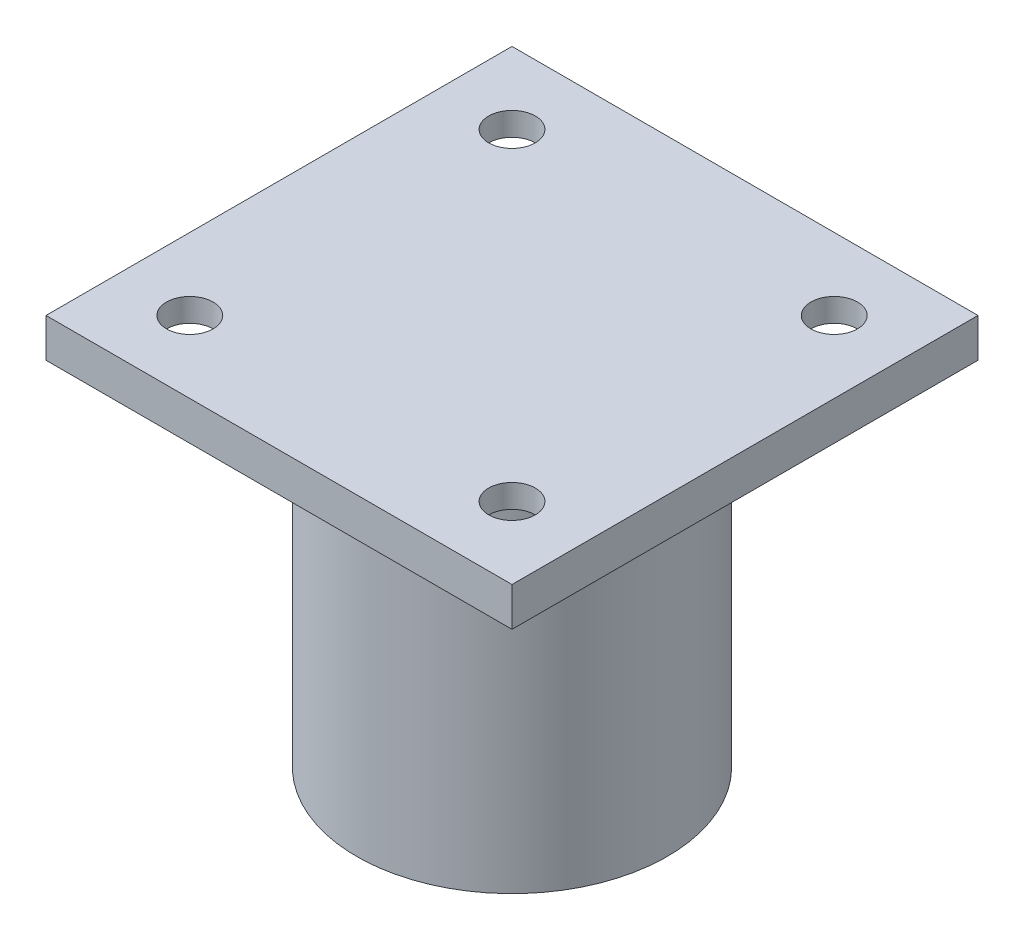
from build123d import *

# Parameters (mm, degrees)
SKETCH1_W           = 45
SKETCH1_H           = 45
BOSS_EXTRUDE1_DEPTH = 3.75
SKETCH2_R           = 15
BOSS_EXTRUDE2_DEPTH = 34
SKETCH3_R           = 2.25
CUT_EXTRUDE1_DEPTH  = 50.371677103
SKETCH4_R           = 5
CUT_EXTRUDE2_DEPTH  = 1.5
SKETCH5_R           = 1.55
CUT_EXTRUDE3_DEPTH  = 15
SKETCH7_R           = 17
BOSS_EXTRUDE3_DEPTH = 4


with BuildPart() as part:
    # Sketch1 → Boss-Extrude1 (new body)
    with BuildSketch(Plane(origin=(0, 0, 0), x_dir=(1, 0, 0), z_dir=(0, 1, 0))):
        Rectangle(SKETCH1_W, SKETCH1_H)
    extrude(amount=BOSS_EXTRUDE1_DEPTH)

    # Sketch2 → Boss-Extrude2 (add)
    with BuildSketch(Plane.XZ):
        with Locations(Location((0, 0, 0), (0, 0, 270))):
            Circle(SKETCH2_R)
    extrude(amount=BOSS_EXTRUDE2_DEPTH)

    # Sketch3 → Cut-Extrude1 (cut, through all)
    with BuildSketch(Plane(origin=(0, 3.75, 0), x_dir=(1, 0, 0), z_dir=(0, 1, 0))):
        with Locations(Location((15.556349186, 15.556349186, 0), (0, 0, 270))):
            Circle(SKETCH3_R)
        with Locations(Location((15.556349186, -15.556349186, 0), (0, 0, 270))):
            Circle(SKETCH3_R)
        with Locations(Location((-15.556349186, -15.556349186, 0), (0, 0, 270))):
            Circle(SKETCH3_R)
        with Locations(Location((-15.556349186, 15.556349186, 0), (0, 0, 270))):
            Circle(SKETCH3_R)
    extrude(amount=-CUT_EXTRUDE1_DEPTH, mode=Mode.SUBTRACT)

    # Sketch4 → Cut-Extrude2 (cut)
    with BuildSketch(Plane.XZ):
        with Locations(Location((-15.556349186, 15.556349186, 0), (0, 0, 270))):
            Circle(SKETCH4_R)
        with Locations(Location((15.556349186, 15.556349186, 0), (0, 0, 90))):
            Circle(SKETCH4_R)
        with Locations(Location((15.556349186, -15.556349186, 0), (0, 0, 270))):
            Circle(SKETCH4_R)
        with Locations(Location((-15.556349186, -15.556349186, 0), (0, 0, 90))):
            Circle(SKETCH4_R)
    extrude(amount=-CUT_EXTRUDE2_DEPTH, mode=Mode.SUBTRACT)

    # Sketch5 → Cut-Extrude3 (cut)
    with BuildSketch(Plane.XZ.offset(34)):
        with Locations(Location((7.5, 0, 0), (0, 0, 270))):
            Circle(SKETCH5_R)
        with Locations(Location((0, -7.5, 0), (0, 0, 270))):
            Circle(SKETCH5_R)
        with Locations(Location((-7.5, 0, 0), (0, 0, 270))):
            Circle(SKETCH5_R)
        with Locations(Location((0, 7.5, 0), (0, 0, 270))):
            Circle(SKETCH5_R)
    extrude(amount=-CUT_EXTRUDE3_DEPTH, mode=Mode.SUBTRACT)

    # Sketch7 → Boss-Extrude3 (add)
    with BuildSketch(Plane.XZ):
        with Locations(Location((0, 0, 0), (0, 0, 134.999906315))):
            Circle(SKETCH7_R)
    extrude(amount=BOSS_EXTRUDE3_DEPTH)


solid = part.part
